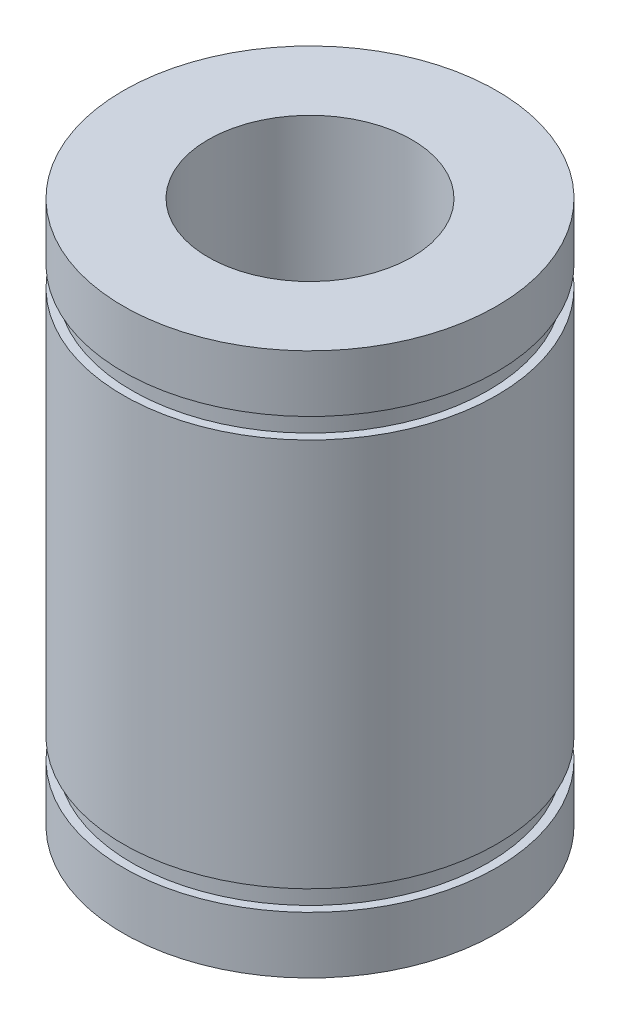
from build123d import *


with BuildPart() as part:
    # Sketch1 → Revolve1 (revolve)
    with BuildSketch(Plane.XY):
        Polygon((6, -16.483823389), (6, 15.516176611), (11, 15.516176611), (11, 12.166176611), (10.5, 12.166176611), (10.5, 10.966176611), (11, 10.966176611), (11, -11.933823389), (10.5, -11.933823389), (10.5, -13.133823389), (11, -13.133823389), (11, -16.483823389), align=None)
    revolve(axis=Axis((0, -1000, 0), (0, 1, 0)))


solid = part.part
